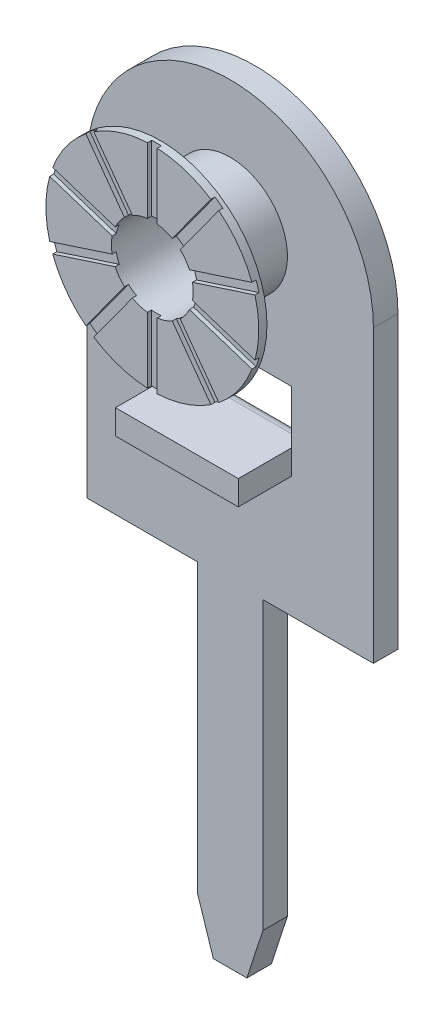
from build123d import *
from OCP.BRepFilletAPI import BRepFilletAPI_MakeChamfer

# Parameters (mm, degrees)
SKETCH1_R           = 0.5
SKETCH1_W           = 1.5
SKETCH1_H           = 0.8
BOSS_EXTRUDE1_DEPTH = 0.15
FILLET1_RADIUS      = 1.75
FILLET1_LENGTH      = 0.3
CHAMFER1_SIZE       = 0.6
CHAMFER1_SIZE2      = 0.194951818
SKETCH2_W           = 1.5
SKETCH2_H           = 0.3
BOSS_EXTRUDE2_DEPTH = 0.8
BOSS_EXTRUDE3_START = -1
BOSS_EXTRUDE3_DEPTH = 1.5
SKETCH4_R           = 0.7
SKETCH4_R_2         = 0.5
BOSS_EXTRUDE4_DEPTH = 1
BOSS_EXTRUDE5_START = 1
SKETCH5_R           = 1.3
SKETCH5_R_2         = 0.5
BOSS_EXTRUDE5_DEPTH = 0.1
CUT_EXTRUDE1_START  = 1.1
CUT_EXTRUDE1_DEPTH  = 0.05


with BuildPart() as part:
    # Sketch1 → Boss-Extrude1 (new, symmetric)
    with BuildSketch(Plane.XY):
        Polygon((-2.15, -5.3), (-3.5, -5.3), (-3.5, 0), (0, 0), (0, -5.3), (-1.35, -5.3), (-1.35, -9.4), (-2.15, -9.4), align=None)
        with Locations((-1.75, -1.52)):
            Circle(SKETCH1_R, mode=Mode.SUBTRACT)
        with Locations((-1.75, -3.27)):
            Rectangle(SKETCH1_W, SKETCH1_H, mode=Mode.SUBTRACT)
    extrude(amount=BOSS_EXTRUDE1_DEPTH, both=True)

    # Fillet1: full round fillet: the end face becomes a half cylinder, R = half its width
    fillet1_face = Plane((-1.75, 0, 0), x_dir=(0, 0, 1), z_dir=(0, 1, 0))  # on the end face: x along it, z out of the body
    fillet1_slab = fillet1_face.offset(-FILLET1_RADIUS / 2) * Box(FILLET1_LENGTH, 2 * FILLET1_RADIUS, FILLET1_RADIUS, mode=Mode.PRIVATE)  # the body's end, R deep
    fillet1_round = Plane((-1.75, -1.75, 0), x_dir=(0, 1, 0), z_dir=(0, 0, 1)) * Cylinder(FILLET1_RADIUS, FILLET1_LENGTH, mode=Mode.PRIVATE)  # its axis R under the face
    add(fillet1_slab - fillet1_round, mode=Mode.SUBTRACT)

    # Chamfer1: one chamfer whose edges measure the first distance from different faces: ONE call of the kernel's chamfer builder (chamfer() names one face for all edges)
    chamfer1_edges_1 = [part.edges().sort_by_distance(p)[0] for p in [
        (-1.35, -9.4, 0),
    ]]
    chamfer1_side_1 = [part.faces().sort_by_distance(p)[0] for p in [
        (-1.35, -7.35, 0),
    ]]
    chamfer1_edges_2 = [part.edges().sort_by_distance(p)[0] for p in [
        (-2.15, -9.4, 0),
    ]]
    chamfer1_side_2 = [part.faces().sort_by_distance(p)[0] for p in [
        (-2.15, -7.35, 0),
    ]]
    chamfer1 = BRepFilletAPI_MakeChamfer(part.part.solid().wrapped)
    for e in chamfer1_edges_1:
        chamfer1.Add(CHAMFER1_SIZE, CHAMFER1_SIZE2, e.wrapped, chamfer1_side_1[0].wrapped)  # the first distance lies on this face
    for e in chamfer1_edges_2:
        chamfer1.Add(CHAMFER1_SIZE, CHAMFER1_SIZE2, e.wrapped, chamfer1_side_2[0].wrapped)  # the first distance lies on this face
    add(Compound.cast(chamfer1.Shape()), mode=Mode.REPLACE)

    # Sketch2 → Boss-Extrude2 (add)
    with BuildSketch(Plane.XY):
        with Locations((-1.75, -3.67)):
            Rectangle(SKETCH2_W, SKETCH2_H)
    extrude(amount=BOSS_EXTRUDE2_DEPTH)

    # Sketch3 → Boss-Extrude3 (add)
    with BuildSketch(Plane(origin=(0, 0, 0), x_dir=(0, 0, -1), z_dir=(1, 0, 0)).offset(BOSS_EXTRUDE3_START)):
        with BuildLine():
            Line((0.15, -3.67), (0, -3.67))
            Line((0, -3.67), (0, -3.52))
            ThreePointArc((0, -3.52), (0.106066017, -3.563933983), (0.15, -3.67))
        make_face()
    extrude(amount=-BOSS_EXTRUDE3_DEPTH)

    # Sketch4 → Boss-Extrude4 (add)
    with BuildSketch(Plane.XY):
        with Locations(Location((-1.75, -1.52, 0), (0, 0, 180))):
            Circle(SKETCH4_R)
        with Locations((-1.75, -1.52)):
            Circle(SKETCH4_R_2, mode=Mode.SUBTRACT)
    extrude(amount=BOSS_EXTRUDE4_DEPTH)

    # Sketch5 → Boss-Extrude5 (add)
    with BuildSketch(Plane.XY.offset(BOSS_EXTRUDE5_START)):
        with Locations((-1.75, -1.52)):
            Circle(SKETCH5_R)
        with Locations((-1.75, -1.52)):
            Circle(SKETCH5_R_2, mode=Mode.SUBTRACT)
    extrude(amount=BOSS_EXTRUDE5_DEPTH)

    # Sketch6 → Cut-Extrude1 (cut)
    with BuildSketch(Plane.XY.offset(CUT_EXTRUDE1_START)):
        Polygon((-1.75, -1.417921903), (-1.69, -1.335338988), (-1.69, -0.22), (-1.81, -0.22), (-1.81, -1.335338988), align=None)
        Polygon((-1.81, -1.437417085), (-1.81, -1.335338988), (-2.465579808, -0.433010792), (-2.562661848, -0.503545022), (-1.907082039, -1.405873218), align=None)
        Polygon((-1.944164079, -1.52), (-1.847082039, -1.488456133), (-1.907082039, -1.405873218), (-2.967832452, -1.061214516), (-3.004914491, -1.175341298), align=None)
        Polygon((-2.967832452, -1.978785484), (-1.907082039, -1.634126782), (-1.847082039, -1.551543867), (-1.944164079, -1.52), (-3.004914491, -1.864658702), align=None)
        Polygon((-1.69, -1.437417085), (-1.592917961, -1.405873218), (-0.937338152, -0.503545022), (-1.034420192, -0.433010792), (-1.69, -1.335338988), align=None)
        Polygon((-1.555835921, -1.52), (-0.495085509, -1.175341298), (-0.532167548, -1.061214516), (-1.592917961, -1.405873218), (-1.652917961, -1.488456133), align=None)
        Polygon((-0.495085509, -1.864658702), (-1.555835921, -1.52), (-1.652917961, -1.551543867), (-1.592917961, -1.634126782), (-0.532167548, -1.978785484), align=None)
        Polygon((-1.81, -1.704661012), (-1.81, -1.602582915), (-1.907082039, -1.634126782), (-2.562661848, -2.536454978), (-2.465579808, -2.606989208), align=None)
        Polygon((-0.937338152, -2.536454978), (-1.592917961, -1.634126782), (-1.69, -1.602582915), (-1.69, -1.704661012), (-1.034420192, -2.606989208), align=None)
        Polygon((-1.69, -2.82), (-1.69, -1.704661012), (-1.75, -1.622078097), (-1.81, -1.704661012), (-1.81, -2.82), align=None)
    extrude(amount=-CUT_EXTRUDE1_DEPTH, mode=Mode.SUBTRACT)


solid = part.part
